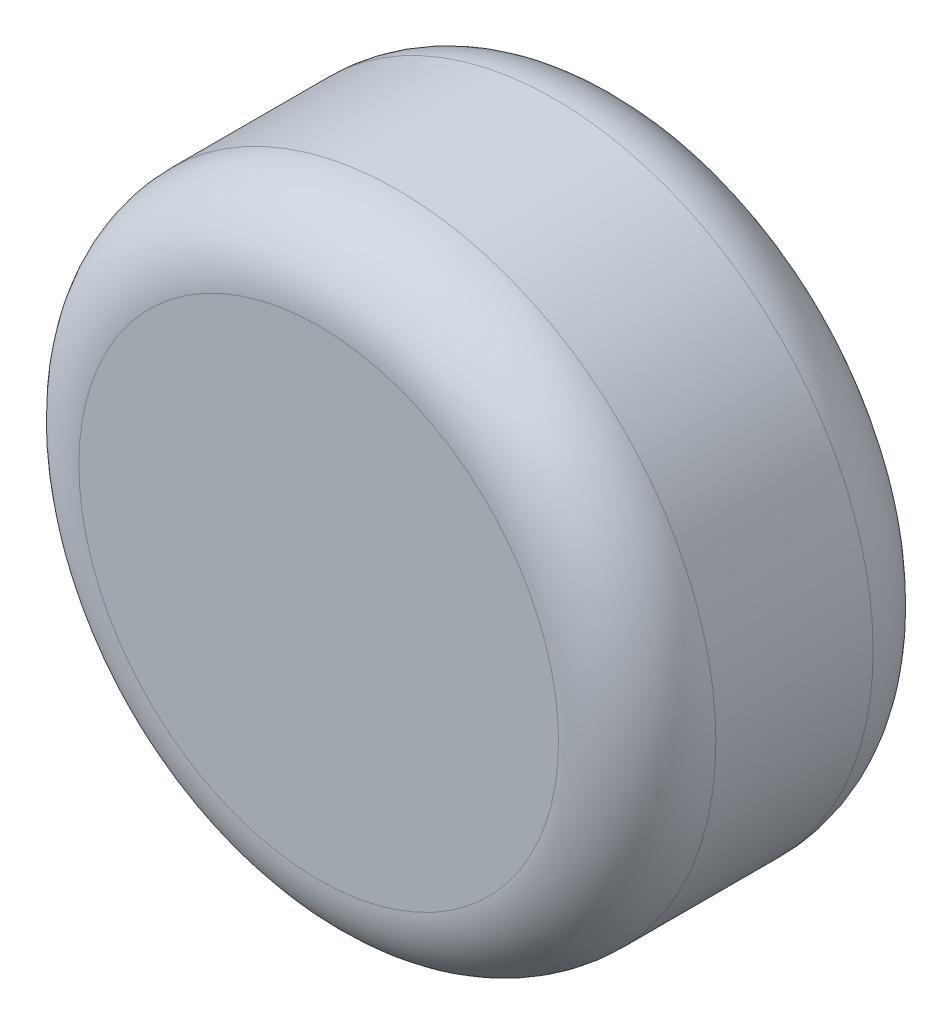
from build123d import *

# Parameters (mm, degrees)
SKETCH_1_R      = 20.25
EXTRUDE_1_DEPTH = 20
FILLET_1_R      = 5


with BuildPart() as part:
    # 草图1 → 凸台-拉伸1 (new body)
    with BuildSketch(Plane.XY):
        Circle(SKETCH_1_R)
    extrude(amount=EXTRUDE_1_DEPTH)

    # 圆角1
    fillet_1_edges = [part.edges().sort_by_distance(p)[0] for p in [
        (-20.25, 0, 0),
        (-20.25, 0, 20),
    ]]
    fillet(fillet_1_edges, radius=FILLET_1_R)


solid = part.part
